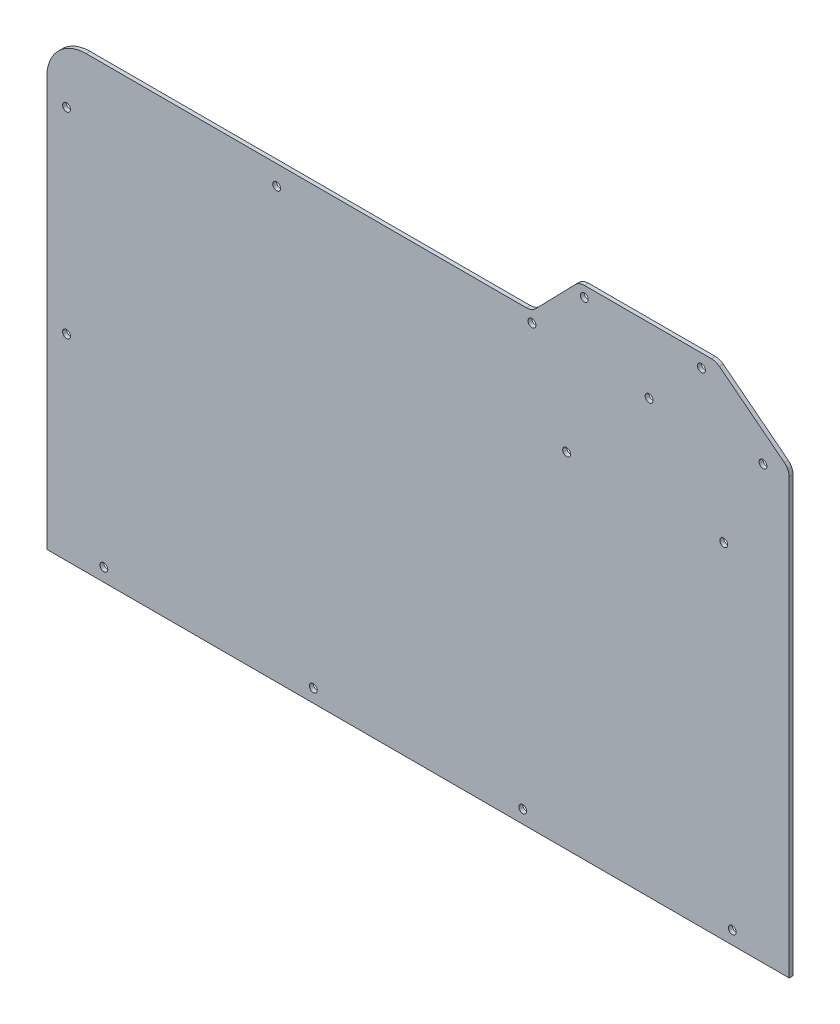
from build123d import *

# Parameters (mm, degrees)
BOSS_EXTRU_1_DEPTH      = 1.5
ESQUISSE2_R             = 1.5
ENL_V_MAT_EXTRU_1_DEPTH = 342.283606404
CONG_1_R                = 5
CONG_2_R                = 15
ESQUISSE3_R             = 1.5
ENL_V_MAT_EXTRU_2_DEPTH = 342.283606404


with BuildPart() as part:
    # Esquisse1 → Boss.-Extru.1 (new body)
    with BuildSketch(Plane.XY):
        Polygon((185.25, 171.5), (203.25, 190), (255.5, 190), (283.5, 168.124002458), (283.5, 0), (0, 0), (0, 171.5), align=None)
    extrude(amount=BOSS_EXTRU_1_DEPTH)

    # Esquisse2 → Enlèv. mat.-Extru.1 (cut, through all)
    with BuildSketch(Plane.XY.offset(1.5)):
        with Locations((261.75, 5)):
            Circle(ESQUISSE2_R)
        with Locations((181.75, 5)):
            Circle(ESQUISSE2_R)
        with Locations((101.75, 5)):
            Circle(ESQUISSE2_R)
        with Locations((21.75, 5)):
            Circle(ESQUISSE2_R)
        with Locations((7.5, 75)):
            Circle(ESQUISSE2_R)
        with Locations((7.5, 150)):
            Circle(ESQUISSE2_R)
        with Locations((87.75, 164)):
            Circle(ESQUISSE2_R)
        with Locations((185.25, 167.5)):
            Circle(ESQUISSE2_R)
        with Locations((205.25, 186)):
            Circle(ESQUISSE2_R)
        with Locations((230, 165)):
            Circle(ESQUISSE2_R)
        with Locations((250, 185)):
            Circle(ESQUISSE2_R)
        with Locations((273.5, 165)):
            Circle(ESQUISSE2_R)
    extrude(amount=-ENL_V_MAT_EXTRU_1_DEPTH, mode=Mode.SUBTRACT)

    # Congé1
    cong_1_edges = [part.edges().sort_by_distance(p)[0] for p in [
        (185.25, 171.5, 0.75),
        (203.25, 190, 0.75),
        (255.5, 190, 0.75),
        (283.5, 168.124002458, 0.75),
    ]]
    fillet(cong_1_edges, radius=CONG_1_R)

    # Congé2
    cong_2_edges = [part.edges().sort_by_distance(p)[0] for p in [
        (0, 171.5, 0.75),
    ]]
    fillet(cong_2_edges, radius=CONG_2_R)

    # Esquisse3 → Enlèv. mat.-Extru.2 (cut, through all)
    with BuildSketch(Plane.XY.offset(1.5)):
        with Locations((198.5, 131.5)):
            Circle(ESQUISSE3_R)
        with Locations((258.5, 131.5)):
            Circle(ESQUISSE3_R)
    extrude(amount=-ENL_V_MAT_EXTRU_2_DEPTH, mode=Mode.SUBTRACT)


solid = part.part
